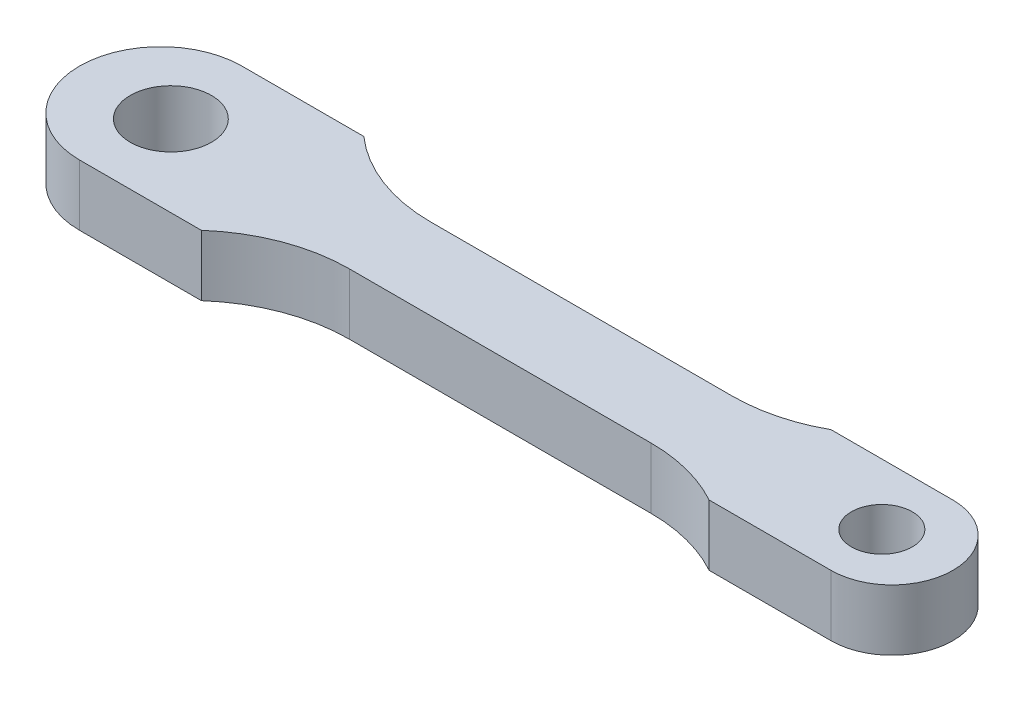
from build123d import *

# Parameters (mm, degrees)
SKETCH1_R           = 2
SKETCH1_R_2         = 1.5
BOSS_EXTRUDE1_DEPTH = 1.5
BOSS_EXTRUDE2_DEPTH = 1.5


with BuildPart() as part:
    # Sketch1 → Boss-Extrude1 (new, symmetric)
    # profile 1 of 4: a face of its own
    with BuildSketch(Plane(origin=(0, 0, 0), x_dir=(1, 0, 0), z_dir=(0, 1, 0))):
        with BuildLine():
            Line((-12, 4), (-18, 4))
            ThreePointArc((-18, 4), (-22, 0), (-18, -4))
            Line((-18, -4), (-12, -4))
            Line((-12, -4), (-12, -2))
            Line((-12, -2), (12, -2))
            Line((12, -2), (12, -3))
            Line((12, -3), (18, -3))
            ThreePointArc((18, -3), (21, 0), (18, 3))
            Line((18, 3), (12, 3))
            Line((12, 3), (12, 2))
            Line((12, 2), (-12, 2))
            Line((-12, 2), (-12, 4))
        make_face()
        with Locations(Location((-17.5, 0, 0), (0, 0, 270))):
            Circle(SKETCH1_R, mode=Mode.SUBTRACT)
        with Locations(Location((17.5, 0, 0), (0, 0, 270))):
            Circle(SKETCH1_R_2, mode=Mode.SUBTRACT)
    # profile 2 of 4: a face of its own
    with BuildSketch(Plane(origin=(0, 0, 0), x_dir=(1, 0, 0), z_dir=(0, 1, 0))):
        with BuildLine():
            Line((12, -2), (8.127016654, -2))
            ThreePointArc((8.127016654, -2), (10.127016654, -2.254033308), (12, -3))
            Line((12, -3), (12, -2))
        make_face()
    # profile 3 of 4: a face of its own
    with BuildSketch(Plane(origin=(0, 0, 0), x_dir=(1, 0, 0), z_dir=(0, 1, 0))):
        with BuildLine():
            Line((-12, -2), (-12, -4))
            ThreePointArc((-12, -4), (-9.536924503, -2.516685226), (-6.708497378, -2))
            Line((-6.708497378, -2), (-12, -2))
        make_face()
    # profile 4 of 4: a face of its own
    with BuildSketch(Plane(origin=(0, 0, 0), x_dir=(1, 0, 0), z_dir=(0, 1, 0))):
        with BuildLine():
            Line((-12, 4), (-12, 2))
            Line((-12, 2), (-6.708497378, 2))
            ThreePointArc((-6.708497378, 2), (-9.536924503, 2.516685226), (-12, 4))
        make_face()
    extrude(amount=BOSS_EXTRUDE1_DEPTH, both=True)

    # Sketch2 → Boss-Extrude2 (add, symmetric)
    with BuildSketch(Plane(origin=(0, 0, 0), x_dir=(1, 0, 0), z_dir=(0, 1, 0))):
        with BuildLine():
            Line((8.127016654, 2), (12, 2))
            Line((12, 2), (12, 3))
            ThreePointArc((12, 3), (10.127016654, 2.254033308), (8.127016654, 2))
        make_face()
    extrude(amount=BOSS_EXTRUDE2_DEPTH, both=True)


solid = part.part
